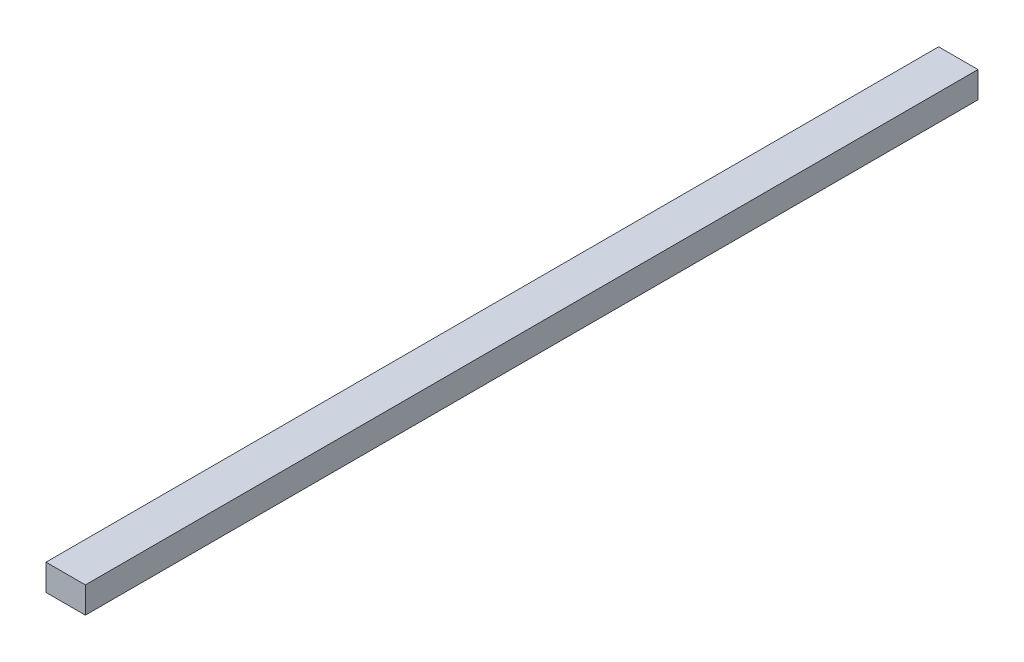
from build123d import *

# Parameters (mm, degrees)
KAP_KIZAK_SOL_30X20_1_START = -20
SKETCH1_W                   = 30
SKETCH1_H                   = 20
KAP_KIZAK_SOL_30X20_1_DEPTH = 680


with BuildPart() as part:
    # Sketch1 → KAP_kizak_sol_30x20_1 (new body)
    with BuildSketch(Plane.XY.offset(KAP_KIZAK_SOL_30X20_1_START)):
        with Locations((-50, 10)):
            Rectangle(SKETCH1_W, SKETCH1_H)
    extrude(amount=-KAP_KIZAK_SOL_30X20_1_DEPTH)


solid = part.part
